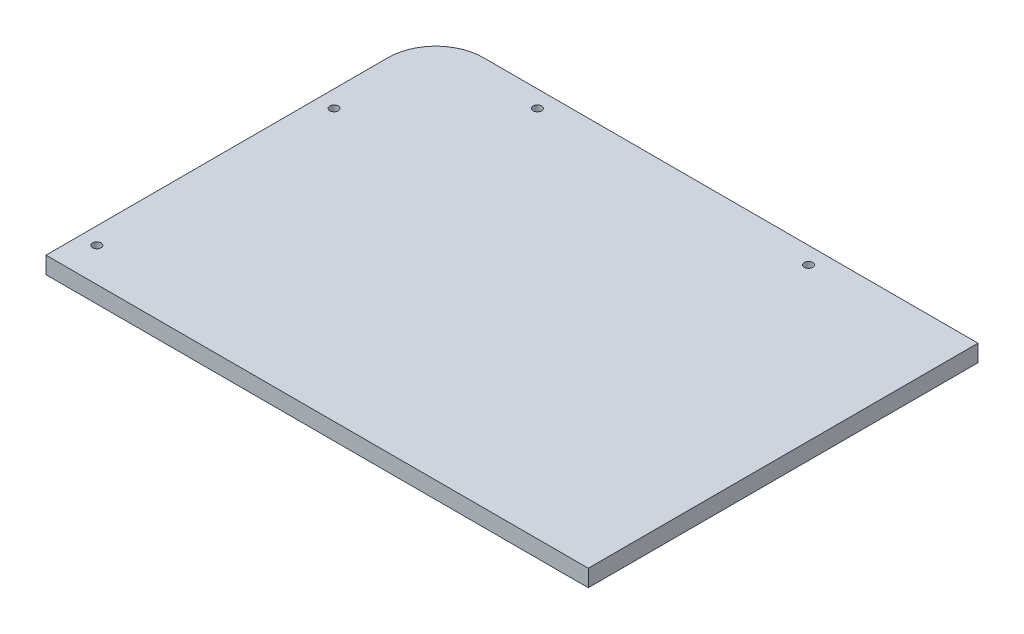
from build123d import *

# Parameters (mm, degrees)
SKETCH1_R           = 1.5875
BOSS_EXTRUDE1_DEPTH = 6.35


with BuildPart() as part:
    # Sketch1 → Boss-Extrude1 (new body)
    with BuildSketch(Plane(origin=(0, 0, 0), x_dir=(1, 0, 0), z_dir=(0, 1, 0))):
        with BuildLine():
            Line((0, 0), (203.2, 0))
            Line((203.2, 0), (203.2, 146.05))
            Line((203.2, 146.05), (17.78, 146.05))
            ThreePointArc((17.78, 146.05), (5.207641431, 140.842358569), (0, 128.27))
            Line((0, 128.27), (0, 0))
        make_face()
        with Locations(Location((6.35, 12.7, 0), (0, 0, 270))):
            Circle(SKETCH1_R, mode=Mode.SUBTRACT)
        with Locations(Location((6.35, 101.6, 0), (0, 0, 270))):
            Circle(SKETCH1_R, mode=Mode.SUBTRACT)
        with Locations(Location((44.45, 139.7, 0), (0, 0, 270))):
            Circle(SKETCH1_R, mode=Mode.SUBTRACT)
        with Locations(Location((146.05, 139.7, 0), (0, 0, 270))):
            Circle(SKETCH1_R, mode=Mode.SUBTRACT)
    extrude(amount=BOSS_EXTRUDE1_DEPTH)


solid = part.part
